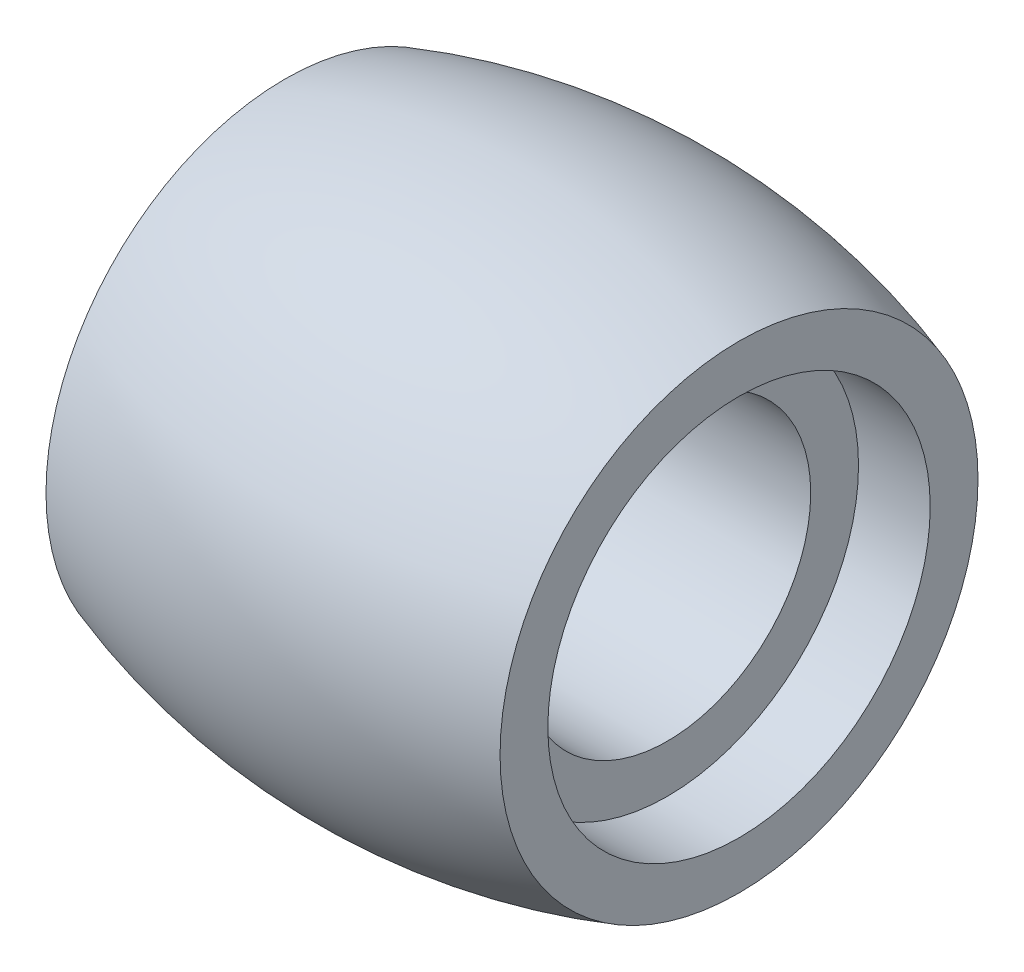
from build123d import *


with BuildPart() as part:
    # Sketch2 → Revolve1 (revolve)
    with BuildSketch(Plane.XY, mode=Mode.PRIVATE) as revolve1_sk:
        with BuildLine():
            Line((-3.25, 3), (3.25, 3))
            Line((3.25, 3), (3.25, 4))
            Line((3.25, 4), (4.75, 4))
            Line((4.75, 4), (4.75, 5))
            ThreePointArc((4.75, 5), (0, 5.771946725), (-4.75, 5))
            Line((-4.75, 5), (-4.75, 4))
            Line((-4.75, 4), (-3.25, 4))
            Line((-3.25, 4), (-3.25, 3))
        make_face()
    revolve(revolve1_sk.sketch.rotate(Axis((-8.91796875, 0, 0), (1, 0, 0)), 90), axis=Axis((-8.91796875, 0, 0), (1, 0, 0)))


solid = part.part
